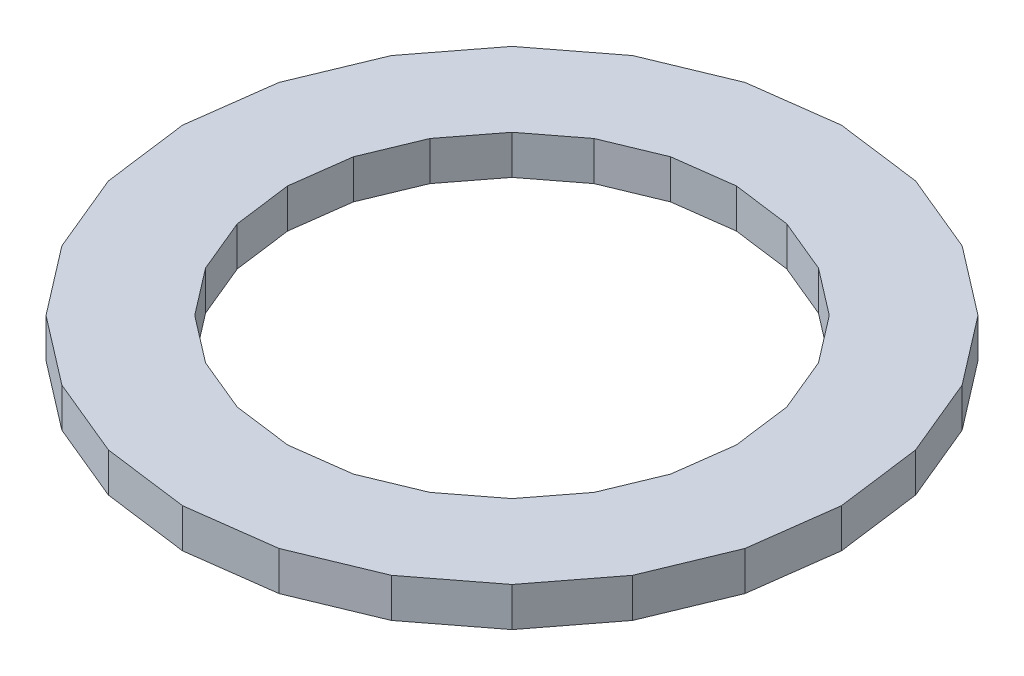
from build123d import *

# Parameters (mm, degrees)
BOSS_EXTRUDE2_DEPTH = 19.05


with BuildPart() as part:
    # Sketch2 → Boss-Extrude2 (new body)
    with BuildSketch(Plane(origin=(0, 0, 0), x_dir=(1, 0, 0), z_dir=(0, 1, 0))):
        Polygon((-160.542490695, 0), (-155.07213798, -41.55145414), (-139.033875329, -80.271245348), (-113.520683839, -113.520683839), (-80.271245348, -139.033875329), (-41.55145414, -155.07213798), (0, -160.542490695), (41.55145414, -155.07213798), (80.271245348, -139.033875329), (113.520683839, -113.520683839), (139.033875329, -80.271245348), (155.07213798, -41.55145414), (160.542490695, 0), (155.07213798, 41.55145414), (139.033875329, 80.271245348), (113.520683839, 113.520683839), (80.271245348, 139.033875329), (41.55145414, 155.07213798), (0, 160.542490695), (-41.55145414, 155.07213798), (-80.271245348, 139.033875329), (-113.520683839, 113.520683839), (-139.033875329, 80.271245348), (-155.07213798, 41.55145414), align=None)
        Polygon((-109.304139498, 0), (-105.579691261, -28.289993011), (-94.660161544, -54.652069749), (-77.289698251, -77.289698251), (-54.652069749, -94.660161544), (-28.289993011, -105.579691261), (0, -109.304139498), (28.289993011, -105.579691261), (54.652069749, -94.660161544), (77.289698251, -77.289698251), (94.660161544, -54.652069749), (105.579691261, -28.289993011), (109.304139498, 0), (105.579691261, 28.289993011), (94.660161544, 54.652069749), (77.289698251, 77.289698251), (54.652069749, 94.660161544), (28.289993011, 105.579691261), (0, 109.304139498), (-28.289993011, 105.579691261), (-54.652069749, 94.660161544), (-77.289698251, 77.289698251), (-94.660161544, 54.652069749), (-105.579691261, 28.289993011), align=None, mode=Mode.SUBTRACT)
    extrude(amount=BOSS_EXTRUDE2_DEPTH)


solid = part.part
